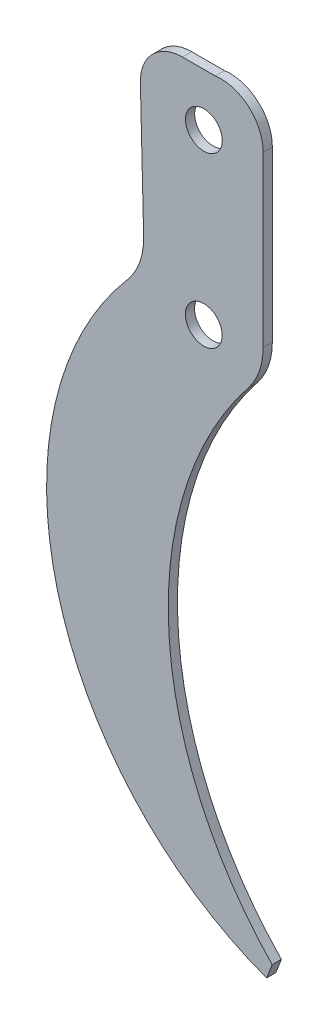
from build123d import *

# Parameters (mm, degrees)
MODEL_R                     = 40
Y_KSEKLIK_EKSTR_ZYON1_DEPTH = 15
Y_KSEKLIK_EKSTR_ZYON3_START = -15
IZIM1_R                     = 40
IZIM1_R_2                   = 30
Y_KSEKLIK_EKSTR_ZYON3_DEPTH = 15


with BuildPart() as part:
    # Model → Yükseklik-Ekstrüzyon1 (new body)
    with BuildSketch(Plane.XY):
        with BuildLine():
            Line((6931.194327476, 3942.086059913), (6931.194327476, 3666.364573938))
            ThreePointArc((6931.194327476, 3666.364573938), (6925.053957557, 3630.147544218), (6907.31914175, 3597.978402283))
            ThreePointArc((6907.31914175, 3597.978402283), (6777.308067831, 3193.270542677), (6945.940945926, 2803.072793589))
            Line((6945.940945926, 2803.072793589), (6936.878955078, 2779.773001275))
            ThreePointArc((6936.878955078, 2779.773001275), (6596.046919437, 3156.739158673), (6710.205052117, 3651.954143388))
            ThreePointArc((6710.205052117, 3651.954143388), (6730.23407164, 3686.587912603), (6736.53537809, 3726.096811981))
            Line((6736.53537809, 3726.096811981), (6731.194327476, 3940.374850843))
            ThreePointArc((6731.194327476, 3940.374850843), (6750.68571305, 3990.036707048), (6799.846461661, 4010.759517411))
            Line((6799.846461661, 4010.759517411), (6853.052157155, 4010.759517411))
            ThreePointArc((6853.052157155, 4010.759517411), (6907.857500774, 3994.326490458), (6931.194327476, 3942.086059913))
        make_face()
        with Locations((6834.632647107, 3925.218631808)):
            Circle(MODEL_R, mode=Mode.SUBTRACT)
        with Locations((6834.469242002, 3650.218631808)):
            Circle(MODEL_R, mode=Mode.SUBTRACT)
    extrude(amount=Y_KSEKLIK_EKSTR_ZYON1_DEPTH)

    # Çizim1 → Yükseklik-Ekstrüzyon3 (add)
    # profile 1 of 2: a face of its own
    with BuildSketch(Plane.XY.offset(15).offset(Y_KSEKLIK_EKSTR_ZYON3_START)):
        with Locations((6834.469242002, 3650.218631808)):
            Circle(IZIM1_R)
        with Locations((6834.469242002, 3650.218631808)):
            Circle(IZIM1_R_2, mode=Mode.SUBTRACT)
    # profile 2 of 2: a face of its own
    with BuildSketch(Plane.XY.offset(15).offset(Y_KSEKLIK_EKSTR_ZYON3_START)):
        with Locations((6834.632647107, 3925.218631808)):
            Circle(IZIM1_R)
        with Locations((6834.632647107, 3925.218631808)):
            Circle(IZIM1_R_2, mode=Mode.SUBTRACT)
    extrude(amount=Y_KSEKLIK_EKSTR_ZYON3_DEPTH)


solid = part.part
